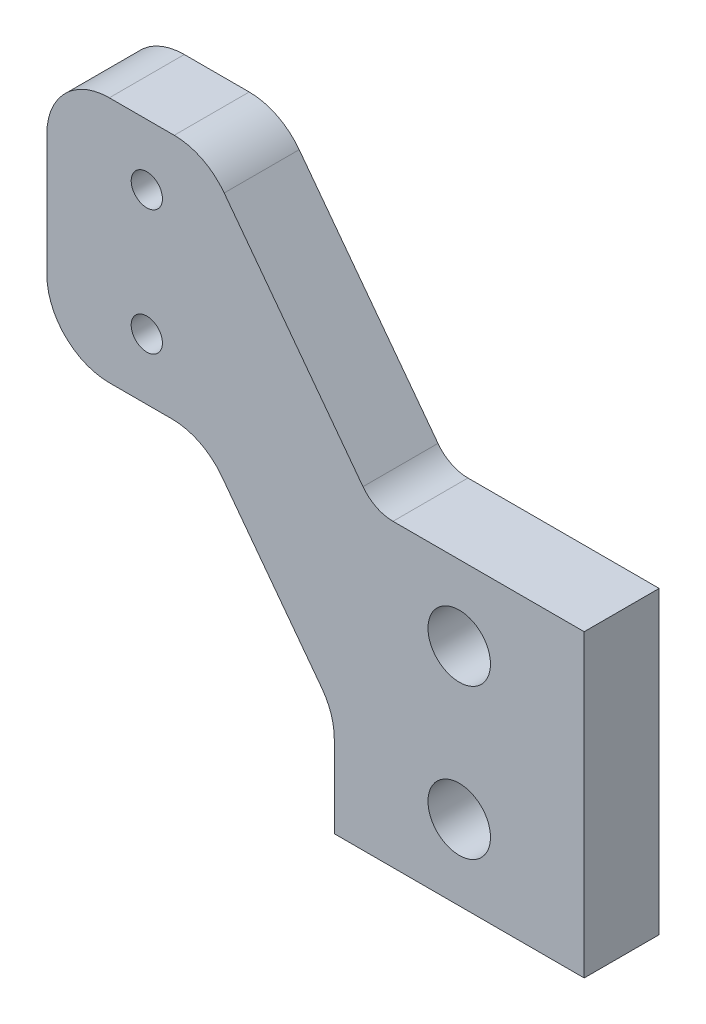
from build123d import *

# Parameters (mm, degrees)
SKETCH_1_R      = 2.5
SKETCH_1_R_2    = 1.25
EXTRUDE_1_DEPTH = 6


with BuildPart() as part:
    # 草图1 → 凸台-拉伸1 (new body)
    with BuildSketch(Plane.XY):
        with BuildLine():
            Line((1.500025947, -1.999165895), (12.605850611, -16.800500463))
            ThreePointArc((12.605850611, -16.800500463), (13.664114192, -17.683421453), (15.005475182, -18))
            Line((15.005475182, -18), (30.306366751, -18))
            Line((30.306366751, -18), (30.306366751, -32.6148543))
            Line((30.306366751, -32.6148543), (30.306366751, -42))
            Line((30.306366751, -42), (10.306366751, -42))
            Line((10.306366751, -42), (10.306366751, -35.397540485))
            ThreePointArc((10.306366751, -35.397540485), (10.049618348, -33.815907061), (9.305741036, -32.39670638))
            Line((9.305741036, -32.39670638), (1.316615651, -21.749165895))
            ThreePointArc((1.316615651, -21.749165895), (-0.447156984, -20.277630912), (-2.682758634, -19.75))
            Line((-2.682758634, -19.75), (-7.693633249, -19.75))
            ThreePointArc((-7.693633249, -19.75), (-11.229167155, -18.285533906), (-12.693633249, -14.75))
            Line((-12.693633249, -14.75), (-12.693633249, -5))
            ThreePointArc((-12.693633249, -5), (-11.229167155, -1.464466094), (-7.693633249, 0))
            Line((-7.693633249, 0), (-2.499348338, 0))
            ThreePointArc((-2.499348338, 0), (-0.263746688, -0.527630912), (1.500025947, -1.999165895))
        make_face()
        with Locations((20.306366751, -36)):
            Circle(SKETCH_1_R, mode=Mode.SUBTRACT)
        with Locations((20.306366751, -24)):
            Circle(SKETCH_1_R, mode=Mode.SUBTRACT)
        with Locations((-4.693633249, -4.875)):
            Circle(SKETCH_1_R_2, mode=Mode.SUBTRACT)
        with Locations((-4.693633249, -14.875)):
            Circle(SKETCH_1_R_2, mode=Mode.SUBTRACT)
    extrude(amount=EXTRUDE_1_DEPTH)


solid = part.part
